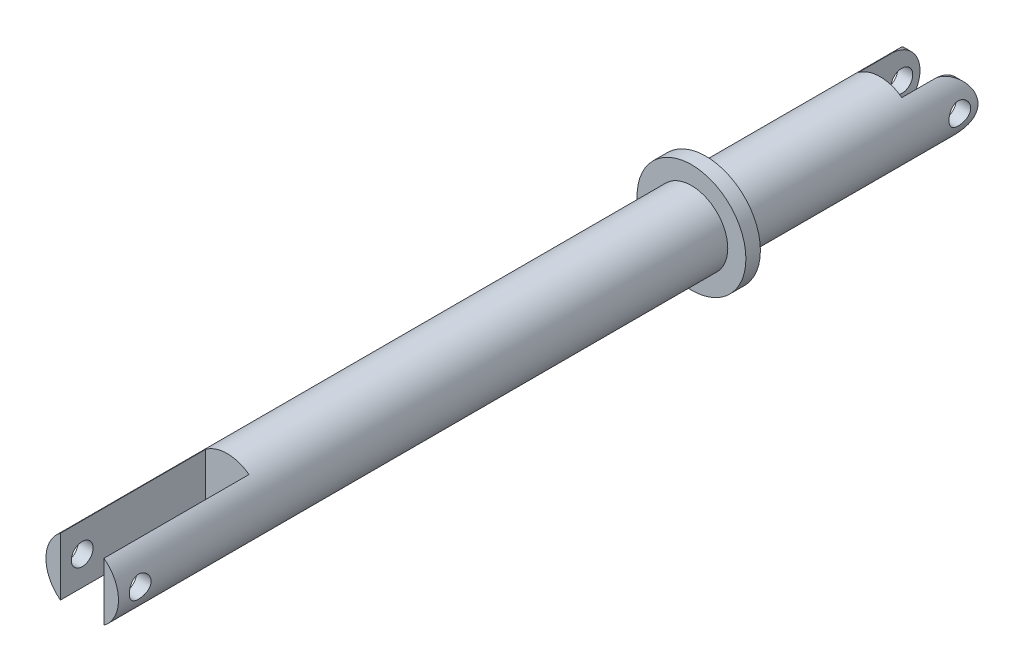
from build123d import *

# Parameters (mm, degrees)
CROQUIS1_R              = 2.5
SALIENTE_EXTRUIR1_DEPTH = 60
SALIENTE_EXTRUIR2_START = -1
CROQUIS2_R              = 3.75
CROQUIS2_R_2            = 2.5
SALIENTE_EXTRUIR2_DEPTH = 1
CROQUIS5_W              = 3
CROQUIS5_H              = 5.669520972
CORTAR_EXTRUIR1_DEPTH   = 10
CROQUIS6_R              = 0.75
CORTAR_EXTRUIR2_DEPTH   = 4.5
CROQUIS7_W              = 3
CROQUIS7_H              = 6.567565146
CORTAR_EXTRUIR3_DEPTH   = 5
CROQUIS8_R              = 0.75
CORTAR_EXTRUIR4_DEPTH   = 5
CORTAR_EXTRUIR5_DEPTH   = 5


with BuildPart() as part:
    # Croquis1 → Saliente-Extruir1 (new body)
    with BuildSketch(Plane.XY):
        Circle(CROQUIS1_R)
    extrude(amount=SALIENTE_EXTRUIR1_DEPTH)

    # Croquis2 → Saliente-Extruir2 (add)
    with BuildSketch(Plane.XY.offset(18).offset(SALIENTE_EXTRUIR2_START)):
        Circle(CROQUIS2_R)
        Circle(CROQUIS2_R_2, mode=Mode.SUBTRACT)
    extrude(amount=SALIENTE_EXTRUIR2_DEPTH)

    # Croquis5 → Cortar-Extruir1 (cut, symmetric)
    with BuildSketch(Plane.XY.offset(60)):
        Rectangle(CROQUIS5_W, CROQUIS5_H)
    extrude(amount=CORTAR_EXTRUIR1_DEPTH, both=True, mode=Mode.SUBTRACT)

    # Croquis6 → Cortar-Extruir2 (cut, symmetric)
    with BuildSketch(Plane.ZY.offset(-1.5)):
        with Locations((58.5, 0)):
            Circle(CROQUIS6_R)
    extrude(amount=CORTAR_EXTRUIR2_DEPTH, both=True, mode=Mode.SUBTRACT)

    # Croquis7 → Cortar-Extruir3 (cut)
    with BuildSketch(Plane(origin=(0, 0, 0), x_dir=(-1, 0, 0), z_dir=(0, 0, -1))):
        Rectangle(CROQUIS7_W, CROQUIS7_H)
    extrude(amount=-CORTAR_EXTRUIR3_DEPTH, mode=Mode.SUBTRACT)

    # Croquis8 → Cortar-Extruir4 (cut, symmetric)
    with BuildSketch(Plane.ZY.offset(-1.5)):
        with Locations((2, 0)):
            Circle(CROQUIS8_R)
    extrude(amount=CORTAR_EXTRUIR4_DEPTH, both=True, mode=Mode.SUBTRACT)

    # Croquis9 → Cortar-Extruir5 (cut, symmetric)
    with BuildSketch(Plane.ZY.offset(-1.5)):
        with BuildLine():
            Line((0, 2), (2.75, 2))
            ThreePointArc((2.75, 2), (0.75, 0), (2.75, -2))
            Line((2.75, -2), (0, -2))
            Line((0, -2), (0, 2))
        make_face()
    extrude(amount=CORTAR_EXTRUIR5_DEPTH, both=True, mode=Mode.SUBTRACT)


solid = part.part
